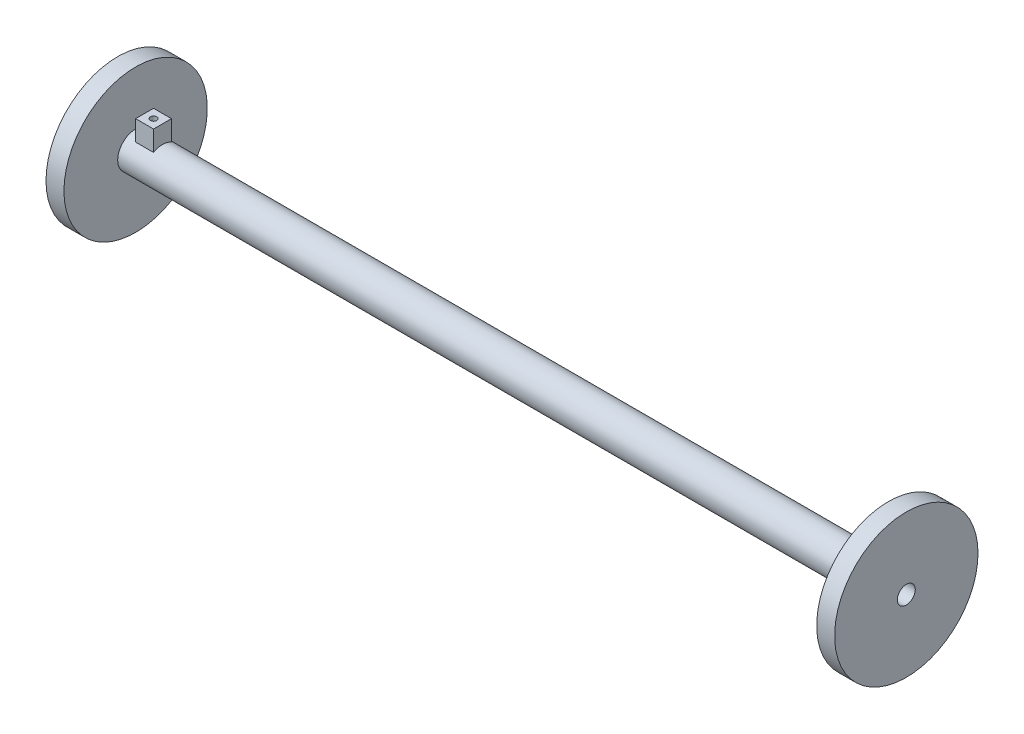
from build123d import *

# Parameters (mm, degrees)
SKETCH1_R                = 12.7
SKETCH1_R_2              = 6.35
BOSS_EXTRUDE1_DEPTH      = 279.4
BOSS_EXTRUDE2_START      = -12.7
SKETCH2_R                = 50.8
SKETCH2_R_2              = 6.35
BOSS_EXTRUDE2_DEPTH      = 12.7
SKETCH3_R                = 50.8
SKETCH3_R_2              = 6.35
BOSS_EXTRUDE3_DEPTH      = 12.7
BOSS_EXTRUDE4_REACH      = 315.889
BOSS_EXTRUDE4_END_RADIUS = 12.7
BOSS_EXTRUDE4_START      = 25.4
SKETCH4_W                = 12.7
SKETCH4_H                = 12.7
SKETCH4_R                = 2.286


with BuildPart() as part:
    # Sketch1 → Boss-Extrude1 (new, symmetric)
    with BuildSketch(Plane(origin=(0, 0, 0), x_dir=(0, 0, -1), z_dir=(1, 0, 0))):
        Circle(SKETCH1_R)
        Circle(SKETCH1_R_2, mode=Mode.SUBTRACT)
    extrude(amount=BOSS_EXTRUDE1_DEPTH, both=True)

    # Sketch2 → Boss-Extrude2 (add)
    with BuildSketch(Plane(origin=(279.4, 0, 0), x_dir=(0, 0, -1), z_dir=(1, 0, 0)).offset(BOSS_EXTRUDE2_START)):
        Circle(SKETCH2_R)
        Circle(SKETCH2_R_2, mode=Mode.SUBTRACT)
    extrude(amount=BOSS_EXTRUDE2_DEPTH)

    # Sketch3 → Boss-Extrude3 (add)
    with BuildSketch(Plane.ZY.offset(279.4)):
        with Locations(Location((0, 0, 0), (0, 0, 180))):
            Circle(SKETCH3_R)
        with Locations(Location((0, 0, 0), (0, 0, 180))):
            Circle(SKETCH3_R_2, mode=Mode.SUBTRACT)
    extrude(amount=-BOSS_EXTRUDE3_DEPTH)

    # Boss-Extrude4: up to this cylinder (the profile starts outside it)
    boss_extrude4_end = Plane(origin=(-254, 0, 0), z_dir=(-1, 0, 0)) * Cylinder(BOSS_EXTRUDE4_END_RADIUS, 658.178, mode=Mode.PRIVATE)
    # Sketch4 → Boss-Extrude4 (add, up to the surface)
    with BuildSketch(Plane(origin=(0, 0, 0), x_dir=(1, 0, 0), z_dir=(0, 1, 0)).offset(BOSS_EXTRUDE4_START), mode=Mode.PRIVATE) as boss_extrude4_sk1:
        with Locations((-254, 0)):
            Rectangle(SKETCH4_W, SKETCH4_H)
        with Locations(Location((-254, 0, 0), (0, 0, 270))):
            Circle(SKETCH4_R, mode=Mode.SUBTRACT)
    boss_extrude4_tool1 = extrude(boss_extrude4_sk1.sketch, amount=-BOSS_EXTRUDE4_REACH, mode=Mode.PRIVATE) - boss_extrude4_end
    add(boss_extrude4_tool1.solids().sort_by_distance((-254, 25.4, 6.170395))[0])


solid = part.part
